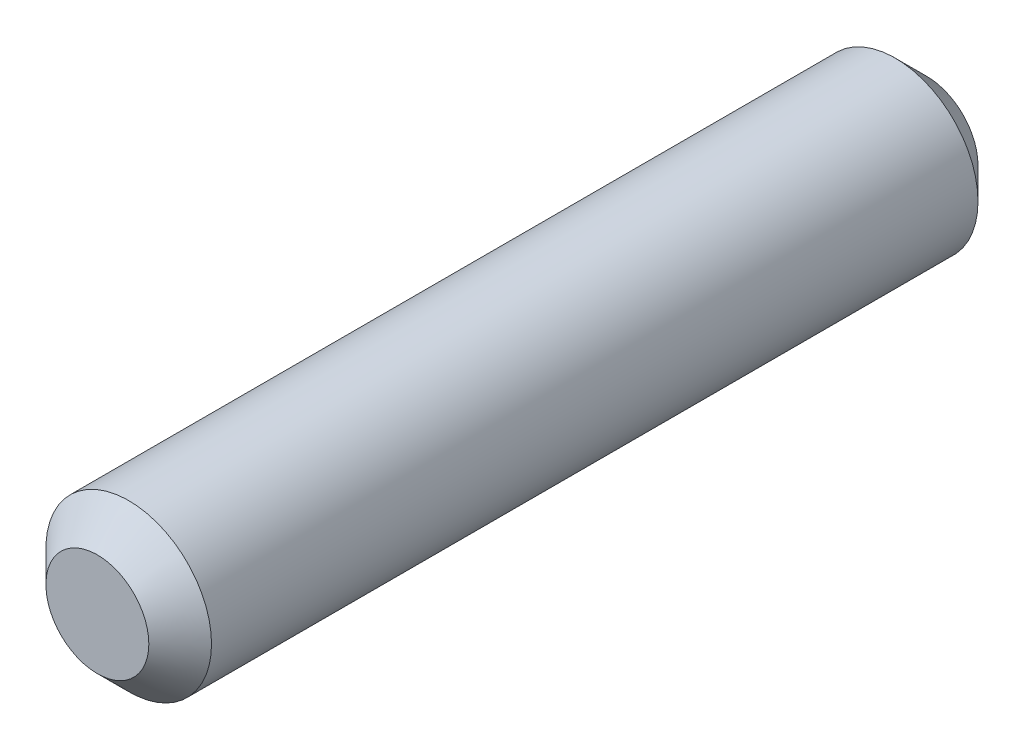
from build123d import *

# Parameters (mm, degrees)
SKETCH1_R           = 1.585
BOSS_EXTRUDE1_DEPTH = 15.87
CHAMFER1_SIZE       = 0.6


with BuildPart() as part:
    # Sketch1 → Boss-Extrude1 (new body)
    with BuildSketch(Plane.XY):
        Circle(SKETCH1_R)
    extrude(amount=BOSS_EXTRUDE1_DEPTH)

    # Chamfer1
    chamfer1_edges = [part.edges().sort_by_distance(p)[0] for p in [
        (-1.585, 0, 0),
        (-1.585, 0, 15.87),
    ]]
    chamfer(chamfer1_edges, length=CHAMFER1_SIZE)


solid = part.part
